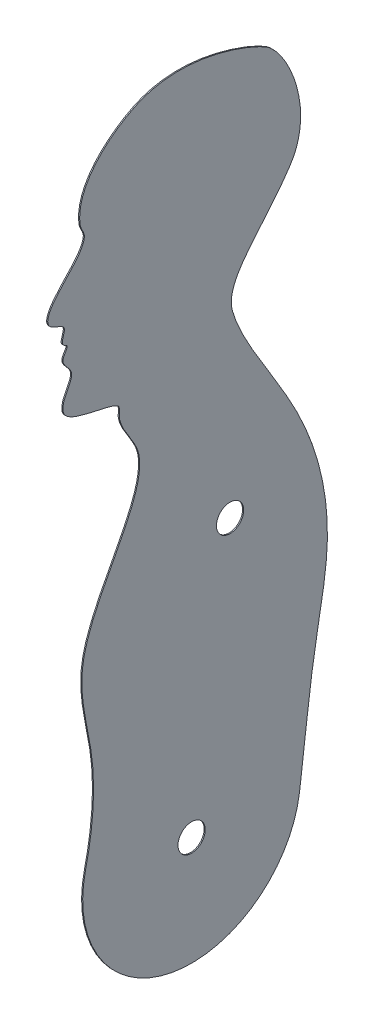
from build123d import *

# Parameters (mm, degrees)
SKETCH3_R      = 12.5
EXTRUDE1_DEPTH = 0.5


with BuildPart() as part:
    # Sketch3 → Extrude1 (new, symmetric)
    with BuildSketch(Plane(origin=(0, 0, 0), x_dir=(0, 0, -1), z_dir=(1, 0, 0))):
        with BuildLine():
            ThreePointArc((-97.417680589, 22.578651612), (-18.003631882, -98.365996356), (99.099578087, -13.389310028))
            add(Edge.make_bspline(
                [(99.099578087, -13.389310028), (104.017666972, 23.011410581), (109.630861187, 83.610992591), (132.41616723, 185.953055105), (106.617940025, 291.436605236), (45.813470952, 369.399968924), (30.039962415, 427.026495123), (66.532874137, 452.480800272), (113.586742992, 524.632643896), (89.589108401, 580.015092802), (69.275374938, 593.676232133)],
                knots=[0, 0, 0, 0, 0.172373302, 0.285416565, 0.484157149, 0.676146622, 0.676146622, 0.843591624, 0.843591624, 1, 1, 1, 1], degree=3))
            add(Edge.make_bspline(
                [(69.275374938, 593.676232133), (57.611796852, 601.520076575), (-6.541939066, 629.513239501), (-78.794124974, 593.748899473), (-106.081624492, 568.241122169), (-101.890807479, 534.208211953), (-98.130242515, 530.407936033), (-99.612009876, 512.185336836), (-126.960547779, 494.491581688), (-135.409739319, 466.734936205), (-108.170746487, 470.435559185), (-121.978079655, 451.106444442), (-111.487572355, 447.867902387), (-123.343503827, 436.942957074), (-100.322805282, 422.721838345), (-119.857922858, 409.261051009), (-115.710119273, 384.097632037), (-75.345194223, 383.299511471), (-65.048388765, 374.577856899), (-66.983379611, 369.63089474), (-63.402767863, 352.792243915), (-52.227992222, 342.639747816), (-38.662555571, 293.342217968), (-118.805661234, 209.877209881), (-86.550426213, 110.237143007), (-89.691216591, 55.915195123), (-97.417680589, 22.578651612)],
                knots=[0, 0, 0, 0, 0.136131893, 0.136131893, 0.213377531, 0.213377531, 0.225241043, 0.225241043, 0.26836174, 0.26836174, 0.305382703, 0.326230765, 0.332002539, 0.34754667, 0.372102163, 0.421707437, 0.421707437, 0.477770818, 0.477770818, 0.49545737, 0.49545737, 0.559790087, 0.559790087, 0.766583246, 0.871741203, 1, 1, 1, 1], degree=3))
        make_face()
        Circle(SKETCH3_R, mode=Mode.SUBTRACT)
        with Locations((35.292326322, 236.415709595)):
            Circle(SKETCH3_R, mode=Mode.SUBTRACT)
    extrude(amount=EXTRUDE1_DEPTH, both=True)


solid = part.part
